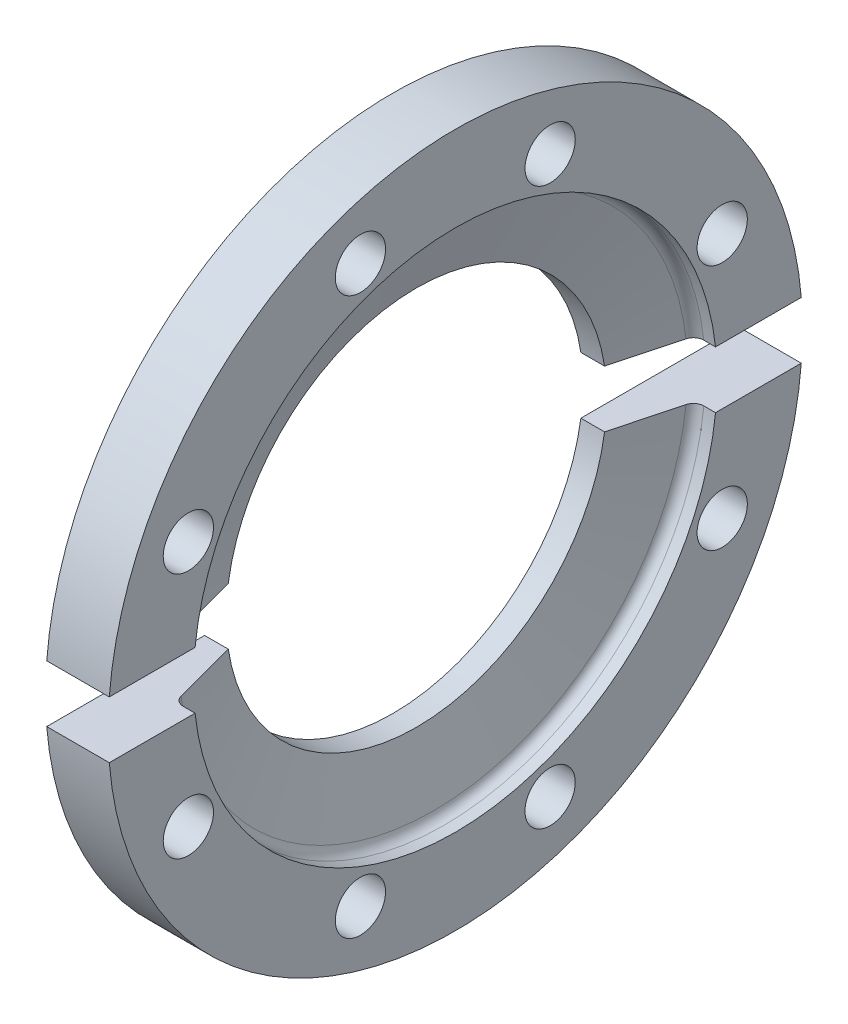
from build123d import *

# Parameters (mm, degrees)
SKETCH4_R          = 2.65
CUT_EXTRUDE1_DEPTH = 10


with BuildPart() as part:
    # Sketch3 → Revolve1 (revolve)
    with BuildSketch(Plane.ZX.offset(27.825791751), mode=Mode.PRIVATE) as revolve1_sk:
        with BuildLine():
            Line((50.688396198, -44.711654686), (41.688396198, -44.711654686))
            Line((41.688396198, -44.711654686), (41.688396198, -45.944086976))
            ThreePointArc((41.688396198, -45.944086976), (41.461084873, -46.613724548), (40.873097148, -47.006605385))
            Line((40.873097148, -47.006605385), (34.149278103, -48.808247268))
            Line((34.149278103, -48.808247268), (34.149278103, -51.308247268))
            Line((34.149278103, -51.308247268), (50.688396198, -51.308247268))
            Line((50.688396198, -51.308247268), (50.688396198, -44.711654686))
        make_face()
    revolve(revolve1_sk.sketch.rotate(Axis((-48.711654686, 27.825791751, 14.088396198), (-1, 0, 0)), 180), axis=Axis((-48.711654686, 27.825791751, 14.088396198), (-1, 0, 0)))

    # Sketch4 → Cut-Extrude1 (cut)
    with BuildSketch(Plane.ZY.offset(51.308247268)):
        with BuildLine():
            Line((33.923692586, 24.825791751), (50.565238167, 24.825791751))
            ThreePointArc((50.565238167, 24.825791751), (50.657593729, 26.324528291), (50.688396198, 27.825791751))
            ThreePointArc((50.688396198, 27.825791751), (50.657593729, 29.327055211), (50.565238167, 30.825791751))
            Line((50.565238167, 30.825791751), (33.923692586, 30.825791751))
            ThreePointArc((33.923692586, 30.825791751), (34.092802228, 29.330026509), (34.149278103, 27.825791751))
            ThreePointArc((34.149278103, 27.825791751), (34.092802228, 26.321556993), (33.923692586, 24.825791751))
        make_face()
        with BuildLine():
            ThreePointArc((-22.38844577, 30.825791751), (-22.511603802, 27.825791751), (-22.38844577, 24.825791751))
            Line((-22.38844577, 24.825791751), (-5.746900189, 24.825791751))
            ThreePointArc((-5.746900189, 24.825791751), (-5.972485706, 27.825791751), (-5.746900189, 30.825791751))
            Line((-5.746900189, 30.825791751), (-22.38844577, 30.825791751))
        make_face()
        with BuildLine():
            Line((-5.746900189, 24.825791751), (33.923692586, 24.825791751))
            ThreePointArc((33.923692586, 24.825791751), (34.092802228, 26.321556993), (34.149278103, 27.825791751))
            ThreePointArc((34.149278103, 27.825791751), (34.092802228, 29.330026509), (33.923692586, 30.825791751))
            Line((33.923692586, 30.825791751), (-5.746900189, 30.825791751))
            ThreePointArc((-5.746900189, 30.825791751), (-5.972485706, 27.825791751), (-5.746900189, 24.825791751))
        make_face()
        with Locations((24.088396198, 57.168593253)):
            Circle(SKETCH4_R)
        with Locations((4.088396198, 57.168593253)):
            Circle(SKETCH4_R)
        with Locations((-14.054098361, 40.825791751)):
            Circle(SKETCH4_R)
        with Locations((-14.054098361, 14.825791751)):
            Circle(SKETCH4_R)
        with Locations((4.088396198, -1.517009751)):
            Circle(SKETCH4_R)
        with Locations((24.088396198, -1.517009751)):
            Circle(SKETCH4_R)
        with Locations((42.230890757, 14.825791751)):
            Circle(SKETCH4_R)
        with Locations((42.230890757, 40.825791751)):
            Circle(SKETCH4_R)
    extrude(amount=-CUT_EXTRUDE1_DEPTH, mode=Mode.SUBTRACT)


with BuildPart() as cut_extrude1_piece_1:
    # of the separate pieces the step leaves, piece 1, a body of its own (cut_extrude1_pieces)
    add(part.part.solids().sort_by_distance((-44.711654686, 24.825791751, -22.38844577))[0])


with BuildPart() as cut_extrude1_piece_2:
    # of the separate pieces the step leaves, piece 2, a body of its own (cut_extrude1_pieces)
    add(part.part.solids().sort_by_distance((-44.711654686, 30.825791751, 50.565238167))[0])


solid = Compound([cut_extrude1_piece_1.part, cut_extrude1_piece_2.part])
